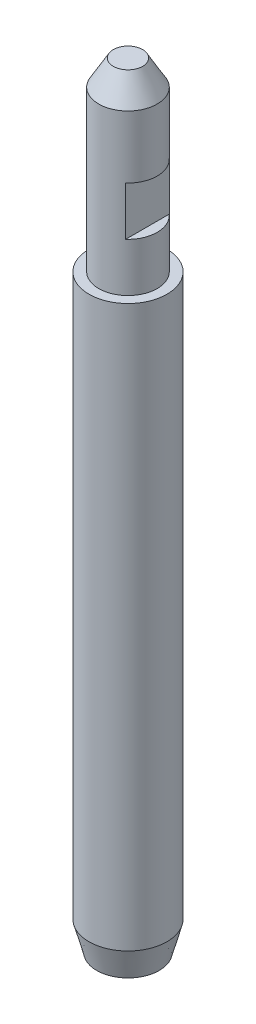
from build123d import *

# Parameters (mm, degrees)
ESQUISSE3_R             = 1.6
ENL_V_MAT_EXTRU_1_DEPTH = 10
ESQUISSE5_W             = 1.955262846
ESQUISSE5_H             = 5
ENL_V_MAT_EXTRU_3_DEPTH = 5.5


with BuildPart() as part:
    # Esquisse1 → Révolution1 (revolve)
    with BuildSketch(Plane.XY, mode=Mode.PRIVATE) as r_volution1_sk:
        Polygon((-101, 30), (-104.208090323, 30), (-105, 32.955447149), (-105, 90.5), (-104, 90.5), (-104, 106.901923789), (-102.5, 109.5), (-101, 109.5), align=None)
    revolve(r_volution1_sk.sketch.rotate(Axis((-101, 106.972874386, 0), (0, -1, 0)), 270), axis=Axis((-101, 106.972874386, 0), (0, -1, 0)))

    # Esquisse3 → Enlèv. mat.-Extru.1 (cut)
    with BuildSketch(Plane.XZ.offset(-30)):
        with Locations(Location((-101, 0, 0), (0, 0, 270))):
            Circle(ESQUISSE3_R)
    extrude(amount=-ENL_V_MAT_EXTRU_1_DEPTH, mode=Mode.SUBTRACT)

    # Esquisse5 → Enlèv. mat.-Extru.3 (cut, symmetric)
    with BuildSketch(Plane.XY):
        with Locations((-103.977631423, 98)):
            Rectangle(ESQUISSE5_W, ESQUISSE5_H)
        with Locations((-98.022368577, 98)):
            Rectangle(ESQUISSE5_W, ESQUISSE5_H)
    extrude(amount=ENL_V_MAT_EXTRU_3_DEPTH, both=True, mode=Mode.SUBTRACT)


solid = part.part
